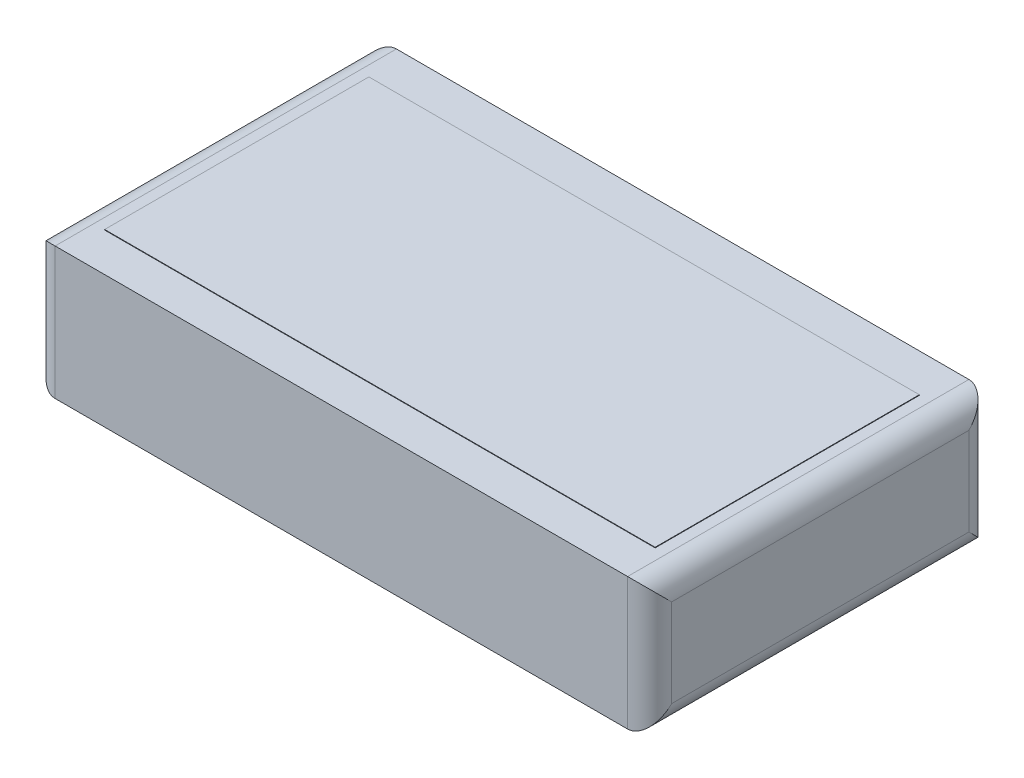
from build123d import *

# Parameters (mm, degrees)
ESBO_O1_W                = 56
ESBO_O1_H                = 12
RESSALTO_EXTRUS_O3_DEPTH = 31
ESBO_O7_W                = 50
ESBO_O7_H                = 24
RESSALTO_EXTRUS_O4_DEPTH = 0.05
FILETE2_R                = 2
FILETE3_R                = 2


with BuildPart() as part:
    # Esboço1 → Ressalto-extrusão3 (new body)
    with BuildSketch(Plane.XY):
        Rectangle(ESBO_O1_W, ESBO_O1_H)
    extrude(amount=RESSALTO_EXTRUS_O3_DEPTH)

    # Esboço7 → Ressalto-extrusão4 (add)
    with BuildSketch(Plane(origin=(0, 6, 0), x_dir=(1, 0, 0), z_dir=(0, 1, 0))):
        with Locations((0, -15.5)):
            Rectangle(ESBO_O7_W, ESBO_O7_H)
    extrude(amount=RESSALTO_EXTRUS_O4_DEPTH)

    # Filete2
    filete2_edges = [part.edges().sort_by_distance(p)[0] for p in [
        (28, 0, 31),
        (28, 0, 0),
        (28, -6, 15.5),
        (28, 6, 15.5),
    ]]
    fillet(filete2_edges, radius=FILETE2_R)

    # Filete3
    filete3_edges = [part.edges().sort_by_distance(p)[0] for p in [
        (-28, 0, 31),
        (-28, 0, 0),
        (-28, -6, 15.5),
        (-28, 6, 15.5),
    ]]
    fillet(filete3_edges, radius=FILETE3_R)


solid = part.part
